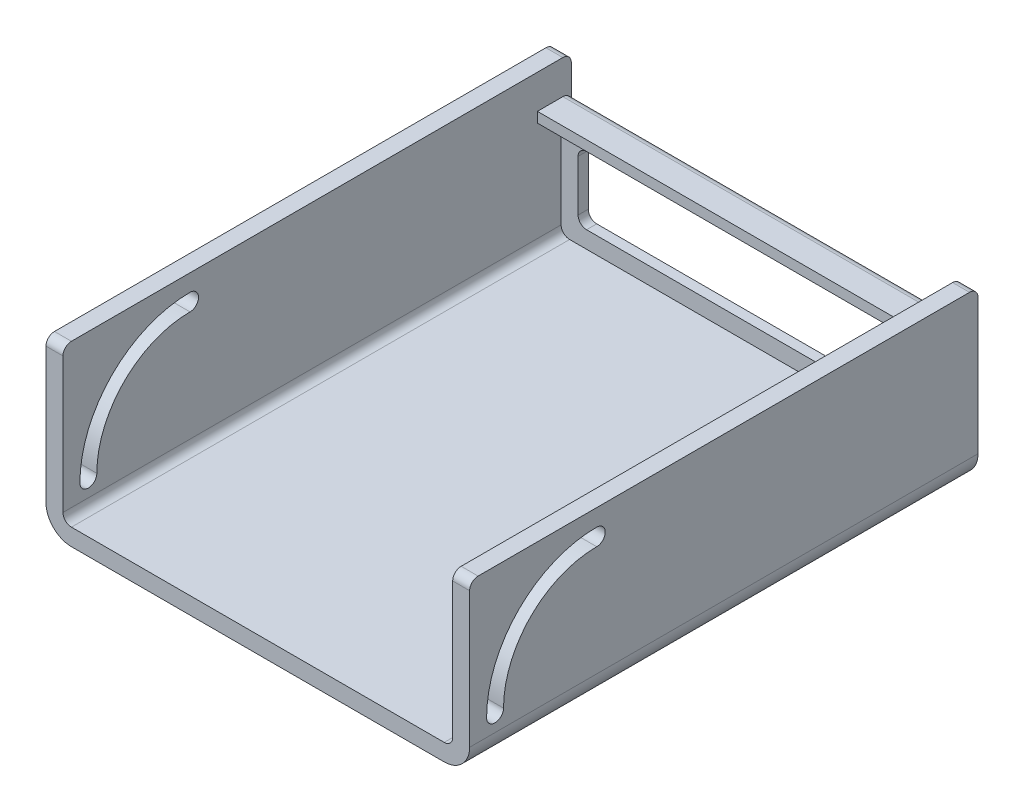
from build123d import *

# Parameters (mm, degrees)
EXTRUDE_THIN1_DEPTH     = 300
CUT_EXTRUDE1_DEPTH      = 341.036762718
CUT_EXTRUDE1_DEPTH_BACK = 341.036762718
BOSS_EXTRUDE1_REACH     = 398.989
CUT_EXTRUDE2_REACH      = 342.037
FILLET1_R               = 5


with BuildPart() as part:
    # Sketch1 → Extrude-Thin1 (new body)
    with BuildSketch(Plane.XY):
        with BuildLine():
            Line((125, 100), (125, 15))
            ThreePointArc((125, 15), (120.606601718, 4.393398282), (110, 0))
            Line((110, 0), (-110, 0))
            ThreePointArc((-110, 0), (-120.606601718, 4.393398282), (-125, 15))
            Line((-125, 15), (-125, 100))
            Line((-125, 100), (-115, 100))
            Line((-115, 100), (-115, 15))
            ThreePointArc((-115, 15), (-113.535533906, 11.464466094), (-110, 10))
            Line((-110, 10), (110, 10))
            ThreePointArc((110, 10), (113.535533906, 11.464466094), (115, 15))
            Line((115, 15), (115, 100))
            Line((115, 100), (125, 100))
        make_face()
    extrude(amount=-EXTRUDE_THIN1_DEPTH)

    # Sketch2 → Cut-Extrude1 (cut, two sides: drawn at the far end of the back side and taken through both)
    with BuildSketch(Plane.ZY.offset(-CUT_EXTRUDE1_DEPTH_BACK)):
        with BuildLine():
            ThreePointArc((-75, 80), (-36.109127035, 63.890872965), (-20, 25))
            ThreePointArc((-20, 25), (-15, 20), (-10, 25))
            ThreePointArc((-10, 25), (-29.038059223, 70.961940777), (-75, 90))
            ThreePointArc((-75, 90), (-80, 85), (-75, 80))
        make_face()
    extrude(amount=CUT_EXTRUDE1_DEPTH + CUT_EXTRUDE1_DEPTH_BACK, mode=Mode.SUBTRACT)

    # Boss-Extrude1: up to this face of the body (flat: up to its plane)
    boss_extrude1_end = Plane(part.part.faces().sort_by_distance((-115, 57.288670869, -154.695150869))[0])
    # Sketch3 → Boss-Extrude1 (add, up to the picked face)
    with BuildSketch(Plane.ZY.offset(-115), mode=Mode.PRIVATE) as boss_extrude1_sk1:
        Polygon((-300, 80), (-280, 80), (-280, 74), (-294, 74), (-294, 10), (-300, 10), align=None)
    boss_extrude1_tool1 = split(extrude(boss_extrude1_sk1.sketch, amount=BOSS_EXTRUDE1_REACH, mode=Mode.PRIVATE), bisect_by=boss_extrude1_end, keep=Keep.BOTH, mode=Mode.PRIVATE)
    add(boss_extrude1_tool1.solids().sort_by(Axis((115, 50.333333, -295.333333), (-1, 0, 0)))[0])

    # Sketch4 → Cut-Extrude2 (cut, up to next)
    with BuildSketch(Plane(origin=(0, 0, -300), x_dir=(-1, 0, 0), z_dir=(0, 0, -1)), mode=Mode.PRIVATE) as cut_extrude2_sk1:
        with BuildLine():
            Line((-100, 60), (100, 60))
            ThreePointArc((100, 60), (103.535533906, 58.535533906), (105, 55))
            Line((105, 55), (105, 25))
            ThreePointArc((105, 25), (103.535533906, 21.464466094), (100, 20))
            Line((100, 20), (-100, 20))
            ThreePointArc((-100, 20), (-103.535533906, 21.464466094), (-105, 25))
            Line((-105, 25), (-105, 55))
            ThreePointArc((-105, 55), (-103.535533906, 58.535533906), (-100, 60))
        make_face()
    cut_extrude2_tool1 = extrude(cut_extrude2_sk1.sketch, amount=-CUT_EXTRUDE2_REACH, mode=Mode.PRIVATE) & part.part
    add(cut_extrude2_tool1.solids().sort_by_distance((0, 40, -300))[0], mode=Mode.SUBTRACT)

    # Fillet1
    fillet1_edges = [part.edges().sort_by_distance(p)[0] for p in [
        (120, 100, 0),
        (-120, 100, 0),
        (120, 100, -300),
        (0, 80, -300),
        (-120, 100, -300),
    ]]
    fillet(fillet1_edges, radius=FILLET1_R)


solid = part.part
